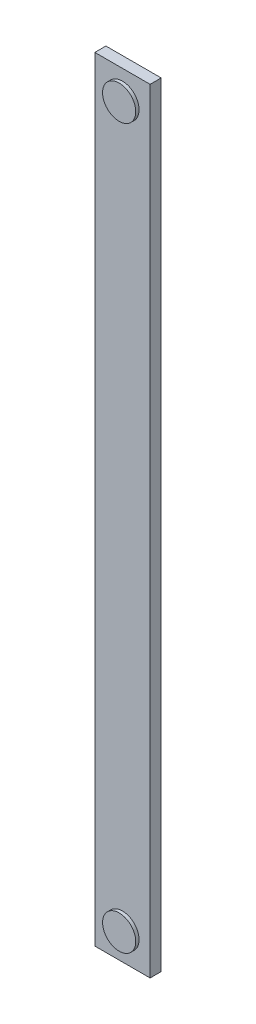
from build123d import *

# Parameters (mm, degrees)
SKETCH1_W           = 50
SKETCH1_H           = 700
BOSS_EXTRUDE1_DEPTH = 5
SKETCH2_R           = 15
BOSS_EXTRUDE2_DEPTH = 3


with BuildPart() as part:
    # Sketch1 → Boss-Extrude1 (new, symmetric)
    with BuildSketch(Plane.XY):
        Rectangle(SKETCH1_W, SKETCH1_H)
    extrude(amount=BOSS_EXTRUDE1_DEPTH, both=True)

    # Sketch2 → Boss-Extrude2 (add)
    with BuildSketch(Plane.XY.offset(5)):
        with Locations((0, -325)):
            Circle(SKETCH2_R)
        with Locations((0, 325)):
            Circle(SKETCH2_R)
    extrude(amount=BOSS_EXTRUDE2_DEPTH)


solid = part.part
